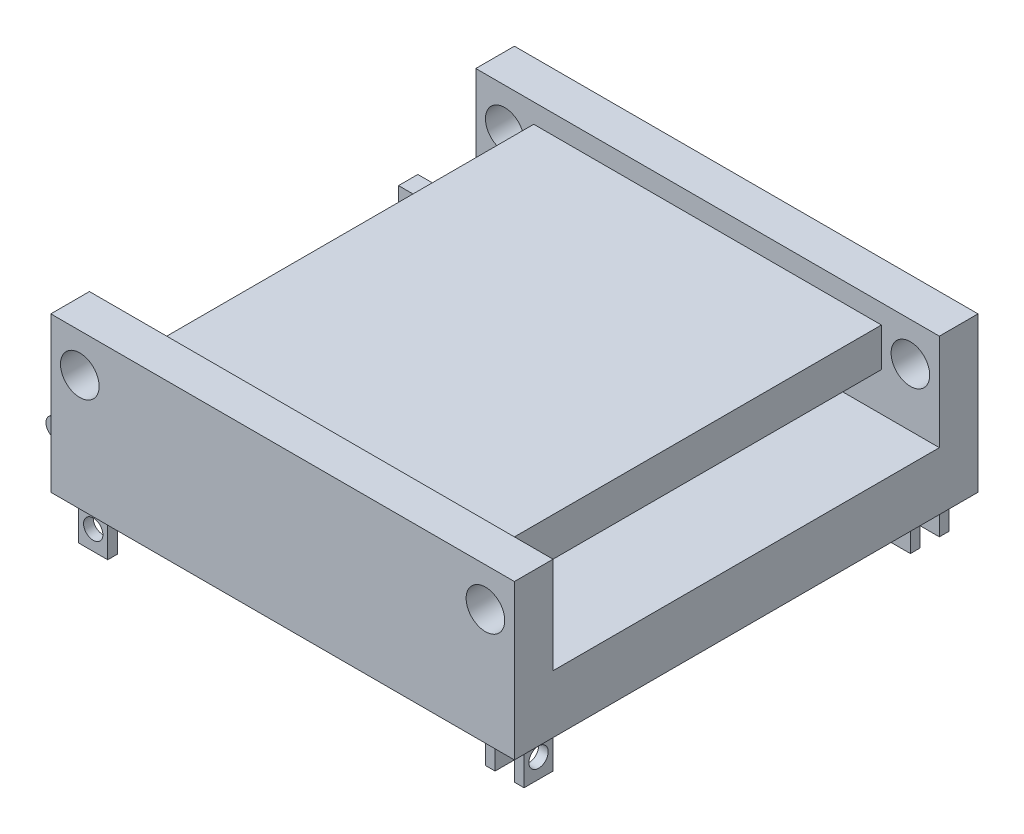
from build123d import *

# Parameters (mm, degrees)
BOSS_EXTRUDE1_DEPTH = 203.2
SKETCH2_W           = 1016
SKETCH2_H           = 1016
CUT_EXTRUDE1_DEPTH  = 50.8
SKETCH3_W           = 1016
SKETCH3_H           = 1016
CUT_EXTRUDE2_DEPTH  = 50.8
SKETCH4_W           = 1016
SKETCH4_H           = 101.6
CUT_EXTRUDE3_DEPTH  = 50.8
SKETCH5_W           = 1016
SKETCH5_H           = 101.6
CUT_EXTRUDE4_DEPTH  = 50.8
SKETCH6_R           = 50.8
CUT_EXTRUDE5_DEPTH  = 1270
SKETCH7_R           = 50.8
CUT_EXTRUDE6_DEPTH  = 1270
SKETCH8_W           = 1219.2
SKETCH8_H           = 101.6
BOSS_EXTRUDE2_DEPTH = 101.6
SKETCH9_W           = 1219.2
SKETCH9_H           = 1219.2
BOSS_EXTRUDE4_DEPTH = 101.6
SKETCH10_W          = 25.4
SKETCH10_H          = 76.2
SKETCH10_W_2        = 76.2
SKETCH10_H_2        = 25.4
BOSS_EXTRUDE5_DEPTH = 101.6
SKETCH12_R          = 25.4
CUT_EXTRUDE7_DEPTH  = 203.2
SKETCH13_R          = 25.4
CUT_EXTRUDE8_DEPTH  = 203.2
SKETCH14_R          = 25.4
CUT_EXTRUDE9_DEPTH  = 203.2
SKETCH15_R          = 25.4
CUT_EXTRUDE10_DEPTH = 203.2
SKETCH16_W          = 1016
SKETCH16_H          = 50.8
BOSS_EXTRUDE6_DEPTH = 1219.2
BOSS_EXTRUDE7_DEPTH = 127
SKETCH18_R          = 25.4
BOSS_EXTRUDE8_DEPTH = 50.8
BOSS_EXTRUDE9_START = 50.8
SKETCH19_R          = 25.4
BOSS_EXTRUDE9_DEPTH = 50.8


with BuildPart() as part:
    # Sketch1 → Boss-Extrude1 (new body)
    with BuildSketch(Plane(origin=(0, 0, 0), x_dir=(1, 0, 0), z_dir=(0, 1, 0))):
        Polygon((0, 0), (1219.2, 0), (1219.2, 101.6), (1117.6, 101.6), (1117.6, 1117.6), (1219.2, 1117.6), (1219.2, 1219.2), (0, 1219.2), (0, 1117.6), (101.6, 1117.6), (101.6, 101.6), (0, 101.6), align=None)
    extrude(amount=BOSS_EXTRUDE1_DEPTH)

    # Sketch2 → Cut-Extrude1 (cut)
    with BuildSketch(Plane(origin=(0, 203.2, 0), x_dir=(1, 0, 0), z_dir=(0, 1, 0))):
        with Locations((609.6, 609.6)):
            Rectangle(SKETCH2_W, SKETCH2_H)
    extrude(amount=-CUT_EXTRUDE1_DEPTH, mode=Mode.SUBTRACT)

    # Sketch3 → Cut-Extrude2 (cut)
    with BuildSketch(Plane(origin=(0, 0, 0), x_dir=(-1, 0, 0), z_dir=(0, -1, 0))):
        with Locations((-609.6, 609.6)):
            Rectangle(SKETCH3_W, SKETCH3_H)
    extrude(amount=-CUT_EXTRUDE2_DEPTH, mode=Mode.SUBTRACT)

    # Sketch4 → Cut-Extrude3 (cut)
    with BuildSketch(Plane(origin=(1117.6, 0, 0), x_dir=(0, 0, -1), z_dir=(1, 0, 0))):
        with Locations((609.6, 101.6)):
            Rectangle(SKETCH4_W, SKETCH4_H)
    extrude(amount=-CUT_EXTRUDE3_DEPTH, mode=Mode.SUBTRACT)

    # Sketch5 → Cut-Extrude4 (cut)
    with BuildSketch(Plane.ZY.offset(-101.6)):
        with Locations((-609.6, 101.6)):
            Rectangle(SKETCH5_W, SKETCH5_H)
    extrude(amount=-CUT_EXTRUDE4_DEPTH, mode=Mode.SUBTRACT)

    # Sketch6 → Cut-Extrude5 (cut)
    with BuildSketch(Plane.XY):
        with Locations((1143, 101.6)):
            Circle(SKETCH6_R)
    extrude(amount=-CUT_EXTRUDE5_DEPTH, mode=Mode.SUBTRACT)

    # Sketch7 → Cut-Extrude6 (cut)
    with BuildSketch(Plane(origin=(0, 0, -1219.2), x_dir=(-1, 0, 0), z_dir=(0, 0, -1))):
        with Locations((-76.2, 101.6)):
            Circle(SKETCH7_R)
    extrude(amount=-CUT_EXTRUDE6_DEPTH, mode=Mode.SUBTRACT)

    # Sketch8 → Boss-Extrude2 (add)
    with BuildSketch(Plane(origin=(0, 0, 0), x_dir=(-1, 0, 0), z_dir=(0, -1, 0))):
        with Locations((-609.6, 50.8)):
            Rectangle(SKETCH8_W, SKETCH8_H)
        with Locations((-609.6, 1168.4)):
            Rectangle(SKETCH8_W, SKETCH8_H)
    extrude(amount=BOSS_EXTRUDE2_DEPTH)

    # Sketch9 → Boss-Extrude4 (add)
    with BuildSketch(Plane(origin=(0, -101.6, 0), x_dir=(-1, 0, 0), z_dir=(0, -1, 0))):
        with Locations((-609.6, 609.6)):
            Rectangle(SKETCH9_W, SKETCH9_H)
    extrude(amount=BOSS_EXTRUDE4_DEPTH)

    # Sketch10 → Boss-Extrude5 (add)
    with BuildSketch(Plane(origin=(0, -203.2, 0), x_dir=(-1, 0, 0), z_dir=(0, -1, 0))):
        with Locations((-1104.9, 88.9)):
            Rectangle(SKETCH10_W, SKETCH10_H)
        with Locations((-1181.1, 88.9)):
            Rectangle(SKETCH10_W, SKETCH10_H)
        with Locations((-88.9, 114.3)):
            Rectangle(SKETCH10_W_2, SKETCH10_H_2)
        with Locations((-88.9, 35.337450191)):
            Rectangle(SKETCH10_W_2, SKETCH10_H_2)
        with Locations((-1130.3, 1104.9)):
            Rectangle(SKETCH10_W_2, SKETCH10_H_2)
        with Locations((-1130.3, 1181.1)):
            Rectangle(SKETCH10_W_2, SKETCH10_H_2)
        with Locations((-38.1, 1130.3)):
            Rectangle(SKETCH10_W, SKETCH10_H)
        with Locations((-114.3, 1130.3)):
            Rectangle(SKETCH10_W, SKETCH10_H)
    extrude(amount=BOSS_EXTRUDE5_DEPTH)

    # Sketch12 → Cut-Extrude7 (cut)
    with BuildSketch(Plane(origin=(1193.8, 0, 0), x_dir=(0, 0, -1), z_dir=(1, 0, 0))):
        with Locations((88.9, -254)):
            Circle(SKETCH12_R)
    extrude(amount=-CUT_EXTRUDE7_DEPTH, mode=Mode.SUBTRACT)

    # Sketch13 → Cut-Extrude8 (cut)
    with BuildSketch(Plane(origin=(0, 0, -1193.8), x_dir=(-1, 0, 0), z_dir=(0, 0, -1))):
        with Locations((-1130.3, -254)):
            Circle(SKETCH13_R)
    extrude(amount=-CUT_EXTRUDE8_DEPTH, mode=Mode.SUBTRACT)

    # Sketch14 → Cut-Extrude9 (cut)
    with BuildSketch(Plane.ZY.offset(-25.4)):
        with Locations(Location((-1130.3, -254, 0), (0, 0, 180))):
            Circle(SKETCH14_R)
    extrude(amount=-CUT_EXTRUDE9_DEPTH, mode=Mode.SUBTRACT)

    # Sketch15 → Cut-Extrude10 (cut)
    with BuildSketch(Plane.XY.offset(-22.637450191)):
        with Locations((88.9, -254)):
            Circle(SKETCH15_R)
    extrude(amount=-CUT_EXTRUDE10_DEPTH, mode=Mode.SUBTRACT)

    # Sketch16 → Boss-Extrude6 (add)
    with BuildSketch(Plane.ZY):
        with Locations((-609.6, -76.2)):
            Rectangle(SKETCH16_W, SKETCH16_H)
    extrude(amount=-BOSS_EXTRUDE6_DEPTH)

    # Sketch17 → Boss-Extrude7 (add)
    with BuildSketch(Plane.ZY):
        Polygon((-1092.2, -165.1), (-1041.4, -165.1), (-1041.4, -127), (-1041.4, -88.9), (-1092.2, -88.9), align=None)
        Polygon((-177.8, -127), (-177.8, -88.9), (-127, -88.9), (-127, -165.1), (-177.8, -165.1), align=None)
    extrude(amount=BOSS_EXTRUDE7_DEPTH)

    # Sketch18 → Boss-Extrude8 (add)
    with BuildSketch(Plane(origin=(0, 0, -1092.2), x_dir=(-1, 0, 0), z_dir=(0, 0, -1))):
        with Locations(Location((63.5, -127, 0), (0, 0, 180))):
            Circle(SKETCH18_R)
    extrude(amount=BOSS_EXTRUDE8_DEPTH)

    # Sketch19 → Boss-Extrude9 (add)
    with BuildSketch(Plane.XY.offset(-127).offset(BOSS_EXTRUDE9_START)):
        with Locations((-63.5, -127)):
            Circle(SKETCH19_R)
    extrude(amount=-BOSS_EXTRUDE9_DEPTH)


solid = part.part
